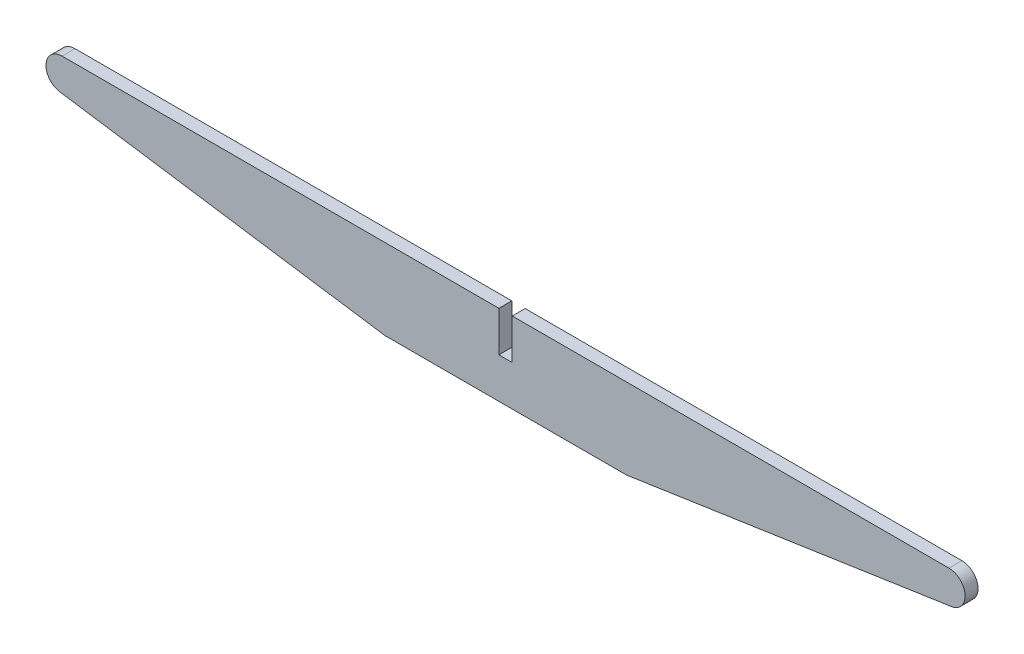
from build123d import *

# Parameters (mm, degrees)
BOSS_EXTRUDE1_DEPTH = 1.6
CUT_EXTRUDE2_REACH  = 117.785
SKETCH2_4_W         = 3.3
SKETCH2_4_H         = 10


with BuildPart() as part:
    # Sketch1 → Boss-Extrude1 (new, symmetric)
    with BuildSketch(Plane.XY):
        with BuildLine():
            Line((-110, 0), (110, 0))
            ThreePointArc((110, 0), (113.989001648, -3.703578255), (110.591213415, -7.956067075))
            Line((110.591213415, -7.956067075), (30, -20))
            Line((30, -20), (0, -20))
            Line((0, -20), (-30, -20))
            Line((-30, -20), (-110.591213415, -7.956067075))
            ThreePointArc((-110.591213415, -7.956067075), (-113.989001648, -3.703578255), (-110, 0))
        make_face()
    extrude(amount=BOSS_EXTRUDE1_DEPTH, both=True)

    # Sketch2<4> → Cut-Extrude2 (cut, up to next)
    with BuildSketch(Plane.XY.offset(1.6), mode=Mode.PRIVATE) as cut_extrude2_sk1:
        with Locations((0, -5)):
            Rectangle(SKETCH2_4_W, SKETCH2_4_H)
    cut_extrude2_tool1 = extrude(cut_extrude2_sk1.sketch, amount=-CUT_EXTRUDE2_REACH, mode=Mode.PRIVATE) & part.part
    add(cut_extrude2_tool1.solids().sort_by_distance((0, -5, 1.6))[0], mode=Mode.SUBTRACT)


solid = part.part
